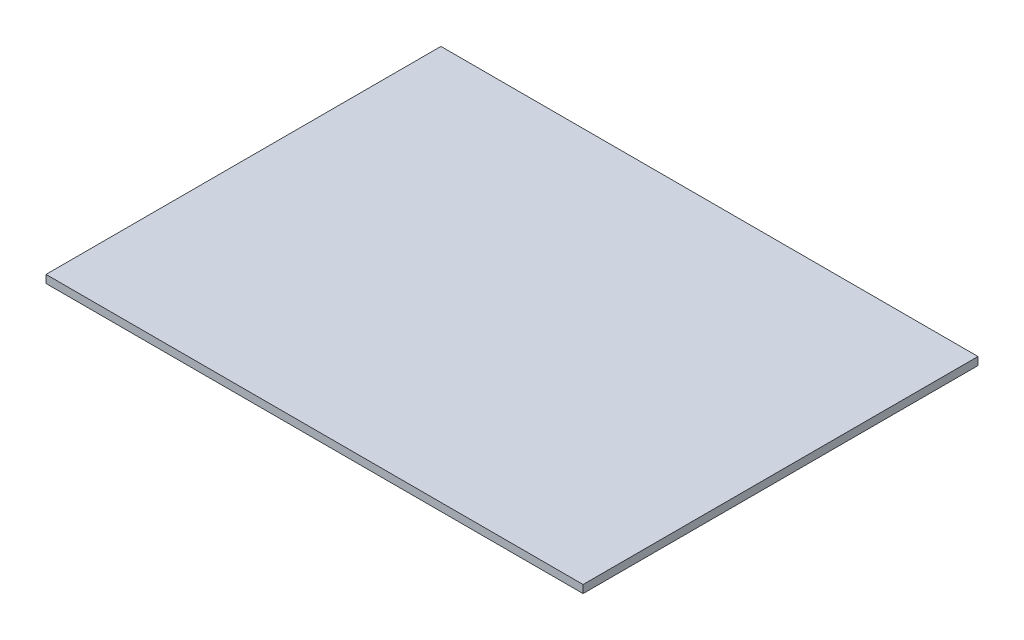
from build123d import *

# Parameters (mm, degrees)
SKETCH1_W           = 340
SKETCH1_H           = 250
BOSS_EXTRUDE1_DEPTH = 5


with BuildPart() as part:
    # Sketch1 → Boss-Extrude1 (new body)
    with BuildSketch(Plane(origin=(0, 0, 0), x_dir=(1, 0, 0), z_dir=(0, 1, 0))):
        Rectangle(SKETCH1_W, SKETCH1_H)
    extrude(amount=BOSS_EXTRUDE1_DEPTH)


solid = part.part
